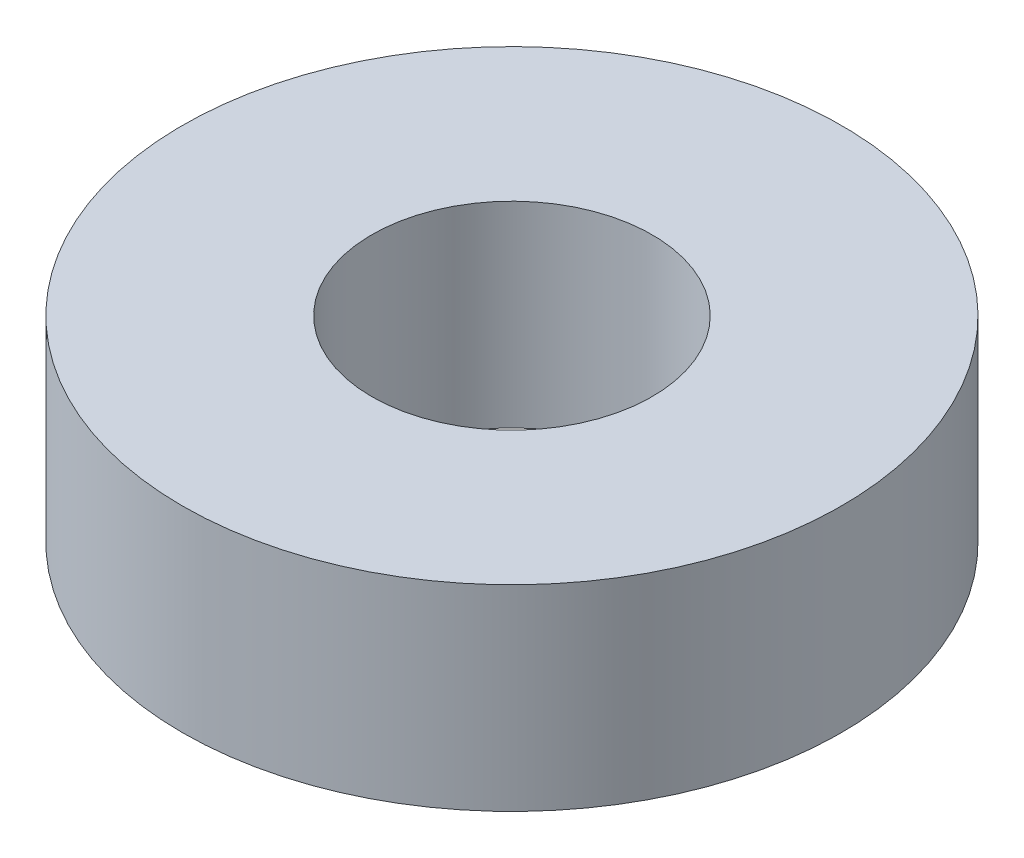
from build123d import *

# Parameters (mm, degrees)
SKETCH1_R                         = 23.5
SKETCH1_R_2                       = 10
REVOLVED_EQUIVALENT_EXTRUDE_DEPTH = 14


with BuildPart() as part:
    # Sketch1 → Revolved_Equivalent_Extrude (new body)
    with BuildSketch(Plane(origin=(0, 0, 0), x_dir=(1, 0, 0), z_dir=(0, 1, 0))):
        with Locations(Location((0, 0, 0), (0, 0, 270))):
            Circle(SKETCH1_R)
        with Locations(Location((0, 0, 0), (0, 0, 270))):
            Circle(SKETCH1_R_2, mode=Mode.SUBTRACT)
    extrude(amount=REVOLVED_EQUIVALENT_EXTRUDE_DEPTH)


solid = part.part
